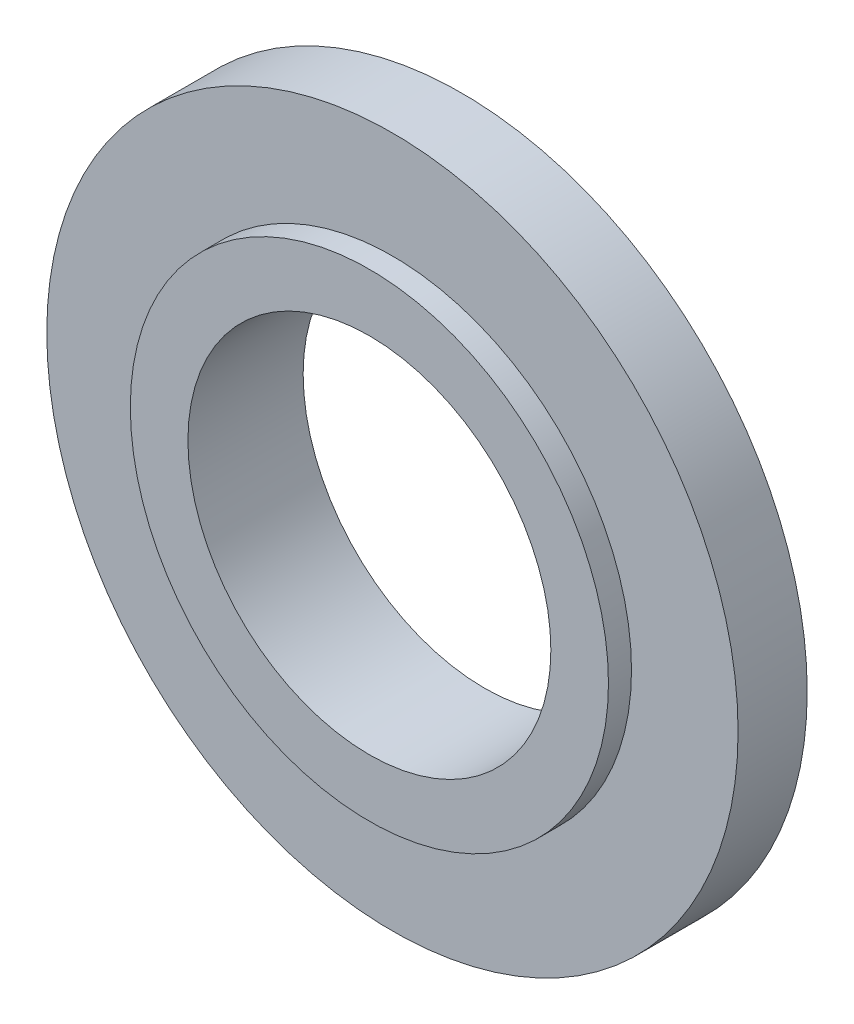
from build123d import *

# Parameters (mm, degrees)
SKETCH_1_R          = 6
SKETCH_1_R_2        = 3.15
EXTRUDE_1_DEPTH     = 2
CUT_EXTRUDE_START   = -0.4
SKETCH_2_R          = 6
SKETCH_2_R_2        = 4.15
CUT_EXTRUDE_1_DEPTH = 0.4
CUT_EXTRUDE_START_2 = -2
SKETCH_2_2_R        = 6
SKETCH_2_2_R_2      = 4.15
CUT_EXTRUDE_2_DEPTH = 0.4


with BuildPart() as part:
    # ｽｹｯﾁ1 → ﾎﾞｽ - 押し出し1 (new body)
    with BuildSketch(Plane.XY):
        Circle(SKETCH_1_R)
        Circle(SKETCH_1_R_2, mode=Mode.SUBTRACT)
    extrude(amount=EXTRUDE_1_DEPTH)

    # ｽｹｯﾁ2 → ｶｯﾄ - 押し出し1 (cut)
    with BuildSketch(Plane.XY.offset(2).offset(CUT_EXTRUDE_START)):
        Circle(SKETCH_2_R)
        Circle(SKETCH_2_R_2, mode=Mode.SUBTRACT)
    extrude(amount=CUT_EXTRUDE_1_DEPTH, mode=Mode.SUBTRACT)

    # ｽｹｯﾁ2<2> → ｶｯﾄ - 押し出し2 (cut)
    with BuildSketch(Plane.XY.offset(2).offset(CUT_EXTRUDE_START_2)):
        Circle(SKETCH_2_2_R)
        Circle(SKETCH_2_2_R_2, mode=Mode.SUBTRACT)
    extrude(amount=CUT_EXTRUDE_2_DEPTH, mode=Mode.SUBTRACT)


solid = part.part
